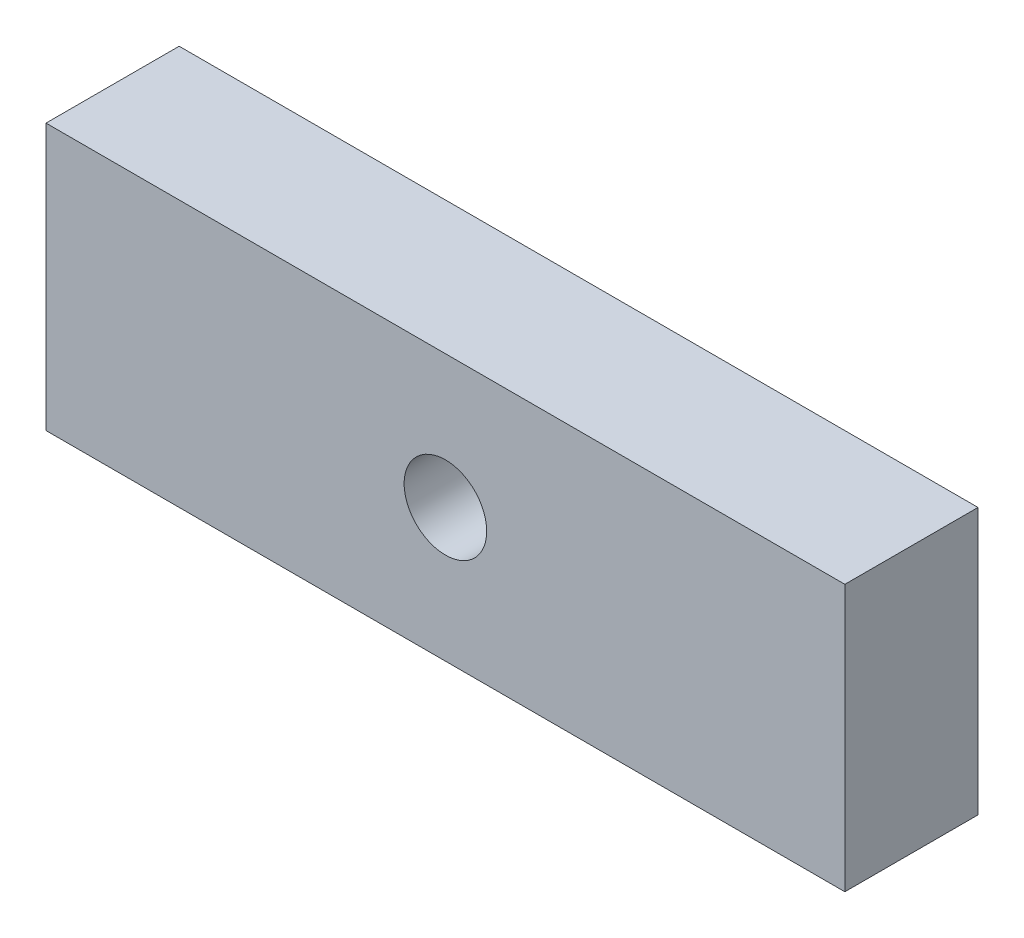
from build123d import *

# Parameters (mm, degrees)
SKETCH1_W           = 60
SKETCH1_H           = 20
SKETCH1_R           = 3.1
BOSS_EXTRUDE1_DEPTH = 10


with BuildPart() as part:
    # Sketch1 → Boss-Extrude1 (new body)
    with BuildSketch(Plane.XY):
        with Locations((30, 10)):
            Rectangle(SKETCH1_W, SKETCH1_H)
        with Locations((30, 10)):
            Circle(SKETCH1_R, mode=Mode.SUBTRACT)
    extrude(amount=BOSS_EXTRUDE1_DEPTH)


solid = part.part
